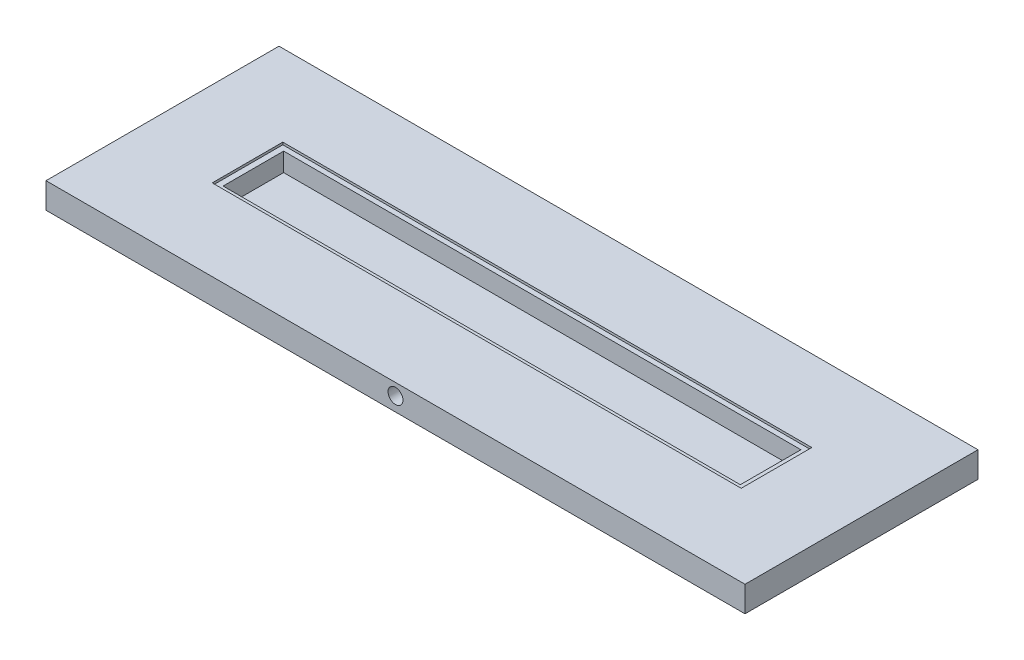
from build123d import *

# Parameters (mm, degrees)
SKETCH19_W               = 1135.16
SKETCH19_H               = 151.52
SKETCH19_W_2             = 1110
SKETCH19_H_2             = 130
BOSS_EXTRUDE2_DEPTH      = 40
SKETCH22_W               = 1135.16
SKETCH22_H               = 151.52
BOSS_EXTRUDE3_DEPTH      = 10
BOSS_EXTRUDE4_DEPTH      = 45
BOSS_EXTRUDE4_DEPTH_BACK = 10
SKETCH23_W               = 1500
SKETCH23_H               = 500
SKETCH23_W_2             = 1135.16
SKETCH23_H_2             = 151.52
SKETCH21_R               = 16
CUT_EXTRUDE5_DEPTH       = 792.849101786


with BuildPart() as part:
    # Sketch19 → Boss-Extrude2 (new body)
    with BuildSketch(Plane(origin=(0, 0, 0), x_dir=(1, 0, 0), z_dir=(0, 1, 0))):
        Rectangle(SKETCH19_W, SKETCH19_H)
        Rectangle(SKETCH19_W_2, SKETCH19_H_2, mode=Mode.SUBTRACT)
    extrude(amount=BOSS_EXTRUDE2_DEPTH)

    # Sketch22 → Boss-Extrude3 (add)
    with BuildSketch(Plane(origin=(0, 0, 0), x_dir=(1, 0, 0), z_dir=(0, 1, 0))):
        Rectangle(SKETCH22_W, SKETCH22_H)
    extrude(amount=-BOSS_EXTRUDE3_DEPTH)

    # Sketch23 → Boss-Extrude4 (add, two sides: drawn at the far end of the back side and taken through both)
    with BuildSketch(Plane(origin=(0, 0, 0), x_dir=(1, 0, 0), z_dir=(0, 1, 0)).offset(-BOSS_EXTRUDE4_DEPTH_BACK)):
        Rectangle(SKETCH23_W, SKETCH23_H)
        Rectangle(SKETCH23_W_2, SKETCH23_H_2, mode=Mode.SUBTRACT)
    extrude(amount=BOSS_EXTRUDE4_DEPTH + BOSS_EXTRUDE4_DEPTH_BACK)

    # Sketch21 → Cut-Extrude5 (cut, through all)
    with BuildSketch(Plane.XY):
        with Locations(Location((0, 20, 0), (0, 0, 180))):
            Circle(SKETCH21_R)
    extrude(amount=CUT_EXTRUDE5_DEPTH, mode=Mode.SUBTRACT)


solid = part.part
